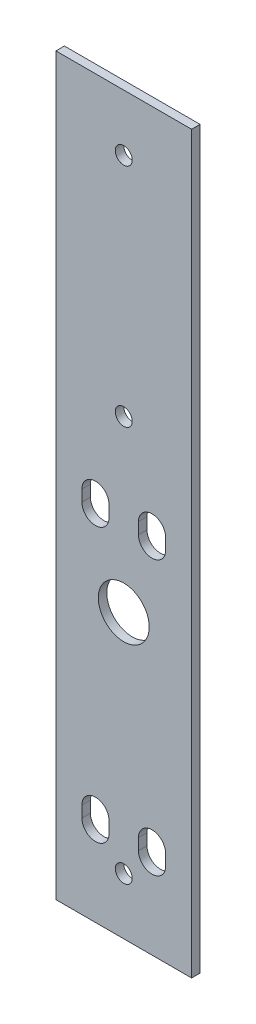
from build123d import *

# Parameters (mm, degrees)
SKETCH_1_W      = 24
SKETCH_1_H      = 130
SKETCH_1_R      = 1.5
SKETCH_1_R_2    = 4.5
EXTRUDE_1_DEPTH = 1.5


with BuildPart() as part:
    # 草图1 → 凸台-拉伸1 (new body)
    with BuildSketch(Plane.XY):
        Rectangle(SKETCH_1_W, SKETCH_1_H)
        with Locations((0, 15)):
            Circle(SKETCH_1_R, mode=Mode.SUBTRACT)
        with Locations((0, -55)):
            Circle(SKETCH_1_R, mode=Mode.SUBTRACT)
        with Locations(Location((0, 55, 0), (0, 0, 180))):
            Circle(SKETCH_1_R, mode=Mode.SUBTRACT)
        with Locations((0, -15)):
            Circle(SKETCH_1_R_2, mode=Mode.SUBTRACT)
        with BuildLine():
            Line((-7.4, -1.8), (-7.4, 0.2))
            ThreePointArc((-7.4, 0.2), (-5, 2.6), (-2.6, 0.2))
            Line((-2.6, 0.2), (-2.6, -1.8))
            ThreePointArc((-2.6, -1.8), (-5, -4.2), (-7.4, -1.8))
        make_face(mode=Mode.SUBTRACT)
        with BuildLine():
            Line((7.4, -1.8), (7.4, 0.2))
            ThreePointArc((7.4, 0.2), (5, 2.6), (2.6, 0.2))
            Line((2.6, 0.2), (2.6, -1.8))
            ThreePointArc((2.6, -1.8), (5, -4.2), (7.4, -1.8))
        make_face(mode=Mode.SUBTRACT)
        with BuildLine():
            Line((-7.4, -48.2), (-7.4, -50.2))
            ThreePointArc((-7.4, -50.2), (-5, -52.6), (-2.6, -50.2))
            Line((-2.6, -50.2), (-2.6, -48.2))
            ThreePointArc((-2.6, -48.2), (-5, -45.8), (-7.4, -48.2))
        make_face(mode=Mode.SUBTRACT)
        with BuildLine():
            Line((7.4, -48.2), (7.4, -50.2))
            ThreePointArc((7.4, -50.2), (5, -52.6), (2.6, -50.2))
            Line((2.6, -50.2), (2.6, -48.2))
            ThreePointArc((2.6, -48.2), (5, -45.8), (7.4, -48.2))
        make_face(mode=Mode.SUBTRACT)
    extrude(amount=EXTRUDE_1_DEPTH)


solid = part.part
